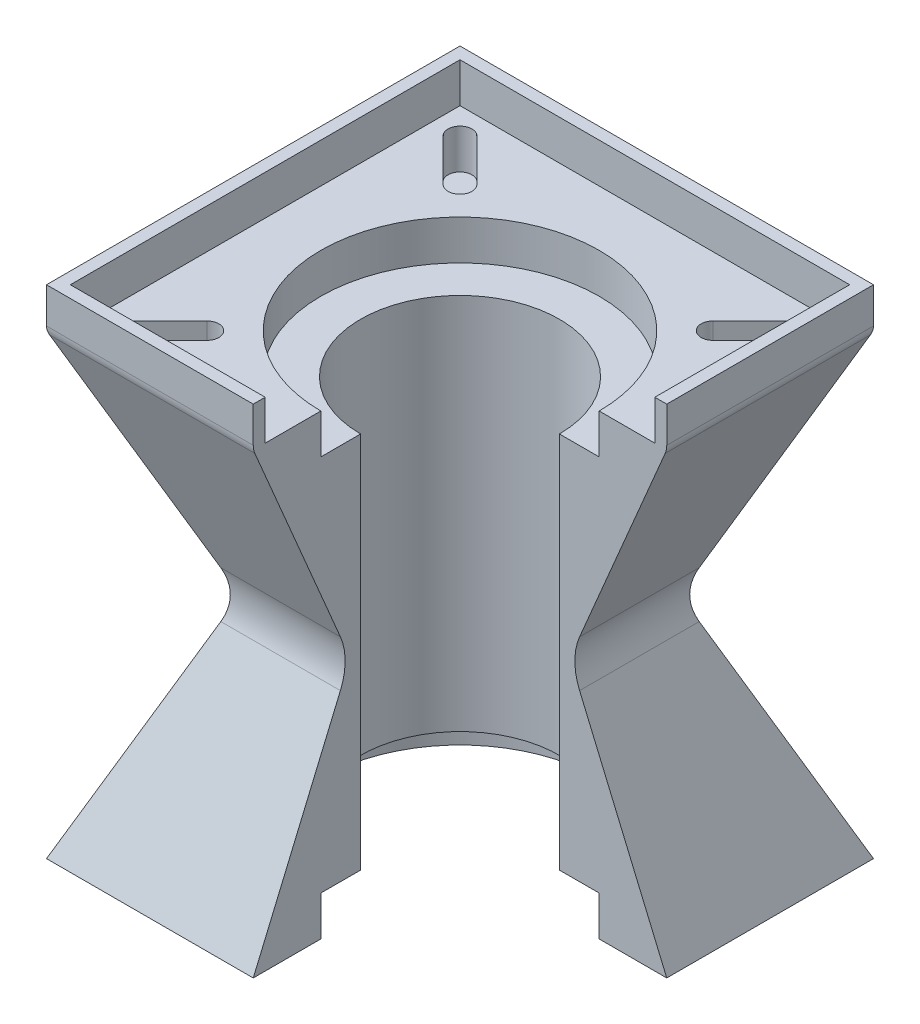
from build123d import *

# Parameters (mm, degrees)
BOSS_EXTRUDE1_DEPTH     = 104
CUT_EXTRUDE1_DEPTH      = 144.028834805
CUT_EXTRUDE1_DEPTH_BACK = 144.028834805
CUT_EXTRUDE2_DEPTH      = 175.287112506
CUT_EXTRUDE2_DEPTH_BACK = 175.287112506
SKETCH5_R               = 25
FILLET1_R               = 15
SKETCH6_R               = 35
CUT_EXTRUDE3_DEPTH      = 10
CUT_EXTRUDE4_START      = -10
SKETCH7_R               = 35
CUT_EXTRUDE4_DEPTH      = 10
CUT_EXTRUDE6_DEPTH      = 168.857074875
CUT_EXTRUDE6_DEPTH_BACK = 168.857074875
SKETCH8_W               = 52
SKETCH8_H               = 52
BOSS_EXTRUDE2_DEPTH     = 10
FILLET2_R               = 5
CUT_EXTRUDE7_DEPTH      = 10


with BuildPart() as part:
    # Sketch2 → Boss-Extrude1 (new body)
    with BuildSketch(Plane.XY):
        Polygon((-55.185396136, 0), (0, 0), (24.407301932, -57.5), (-79.592698068, -57.5), align=None)
        Polygon((-55.185396136, 0), (-79.592698068, 57.5), (24.407301932, 57.5), (0, 0), align=None)
    extrude(amount=BOSS_EXTRUDE1_DEPTH)

    # Sketch4 → Cut-Extrude1 (cut, two sides: drawn at the far end of the back side and taken through both)
    with BuildSketch(Plane(origin=(0, 0, 0), x_dir=(0, 0, -1), z_dir=(1, 0, 0)).offset(-CUT_EXTRUDE1_DEPTH_BACK)):
        Polygon((-104, 57.5), (-79.592698068, 0), (-104, -57.5), align=None)
        Polygon((-24.407301932, 0), (0, -57.5), (0, 57.5), align=None)
    extrude(amount=CUT_EXTRUDE1_DEPTH + CUT_EXTRUDE1_DEPTH_BACK, mode=Mode.SUBTRACT)

    # Sketch5 → Cut-Extrude2 (cut, two sides: drawn at the far end of the back side and taken through both)
    with BuildSketch(Plane(origin=(0, 57.5, 0), x_dir=(1, 0, 0), z_dir=(0, 1, 0)).offset(-CUT_EXTRUDE2_DEPTH_BACK)):
        with Locations(Location((-27.592698068, -52, 0), (0, 0, 270))):
            Circle(SKETCH5_R)
    extrude(amount=CUT_EXTRUDE2_DEPTH + CUT_EXTRUDE2_DEPTH_BACK, mode=Mode.SUBTRACT)

    # Fillet1
    fillet1_edges = [part.edges().sort_by_distance(p)[0] for p in [
        (-55.185396136, 0, 52),
        (0, 0, 52),
        (-27.592698068, 0, 79.592698068),
        (-27.592698068, 0, 24.407301932),
    ]]
    fillet(fillet1_edges, radius=FILLET1_R)

    # Sketch6 → Cut-Extrude3 (cut)
    with BuildSketch(Plane(origin=(0, 57.5, 0), x_dir=(1, 0, 0), z_dir=(0, 1, 0))):
        with Locations(Location((-27.592698068, -52, 0), (0, 0, 270))):
            Circle(SKETCH6_R)
    extrude(amount=-CUT_EXTRUDE3_DEPTH, mode=Mode.SUBTRACT)

    # Sketch7 → Cut-Extrude4 (cut)
    with BuildSketch(Plane.XZ.offset(57.5).offset(CUT_EXTRUDE4_START)):
        with Locations(Location((-27.592698068, 52, 0), (0, 0, 90))):
            Circle(SKETCH7_R)
    extrude(amount=CUT_EXTRUDE4_DEPTH, mode=Mode.SUBTRACT)

    # Sketch8 → Cut-Extrude6 (cut, two sides: drawn at the far end of the back side and taken through both)
    with BuildSketch(Plane(origin=(0, 47.5, 0), x_dir=(1, 0, 0), z_dir=(0, 1, 0)).offset(-CUT_EXTRUDE6_DEPTH_BACK)):
        with Locations((-1.592698068, -78)):
            Rectangle(SKETCH8_W, SKETCH8_H)
    extrude(amount=CUT_EXTRUDE6_DEPTH + CUT_EXTRUDE6_DEPTH_BACK, mode=Mode.SUBTRACT)

    # Sketch9 → Boss-Extrude2 (add)
    with BuildSketch(Plane(origin=(0, 57.5, 0), x_dir=(1, 0, 0), z_dir=(0, 1, 0))):
        Polygon((24.407301932, 0), (-79.592698068, 0), (-79.592698068, -104), (-27.592698068, -104), (-27.592698068, -101), (-76.592698068, -101), (-76.592698068, -3), (21.407301932, -3), (21.407301932, -52), (24.407301932, -52), align=None)
    extrude(amount=BOSS_EXTRUDE2_DEPTH)

    # Fillet2
    fillet2_edges = [part.edges().sort_by_distance(p)[0] for p in [
        (24.407301932, 57.5, 26),
        (-79.592698068, 57.5, 52),
        (-53.592698068, 57.5, 104),
        (-27.592698068, 57.5, 0),
    ]]
    fillet(fillet2_edges, radius=FILLET2_R)

    # Sketch10 → Cut-Extrude7 (cut)
    with BuildSketch(Plane(origin=(0, 57.5, 0), x_dir=(1, 0, 0), z_dir=(0, 1, 0))):
        with BuildLine():
            Line((-72.151375341, -11.683963414), (-61.544773623, -22.290565132))
            ThreePointArc((-61.544773623, -22.290565132), (-57.302132936, -22.290565132), (-57.302132936, -18.047924445))
            Line((-57.302132936, -18.047924445), (-67.908734654, -7.441322727))
            ThreePointArc((-67.908734654, -7.441322727), (-72.151375341, -7.441322727), (-72.151375341, -11.683963414))
        make_face()
        with BuildLine():
            Line((12.723338518, -7.441322727), (2.1167368, -18.047924445))
            ThreePointArc((2.1167368, -18.047924445), (2.1167368, -22.290565132), (6.359377487, -22.290565132))
            Line((6.359377487, -22.290565132), (16.965979205, -11.683963414))
            ThreePointArc((16.965979205, -11.683963414), (16.965979205, -7.441322727), (12.723338518, -7.441322727))
        make_face()
        with BuildLine():
            Line((-67.908734654, -96.558677273), (-57.302132936, -85.952075555))
            ThreePointArc((-57.302132936, -85.952075555), (-57.302132936, -81.709434868), (-61.544773623, -81.709434868))
            Line((-61.544773623, -81.709434868), (-72.151375341, -92.316036586))
            ThreePointArc((-72.151375341, -92.316036586), (-72.151375341, -96.558677273), (-67.908734654, -96.558677273))
        make_face()
    extrude(amount=-CUT_EXTRUDE7_DEPTH, mode=Mode.SUBTRACT)


solid = part.part
